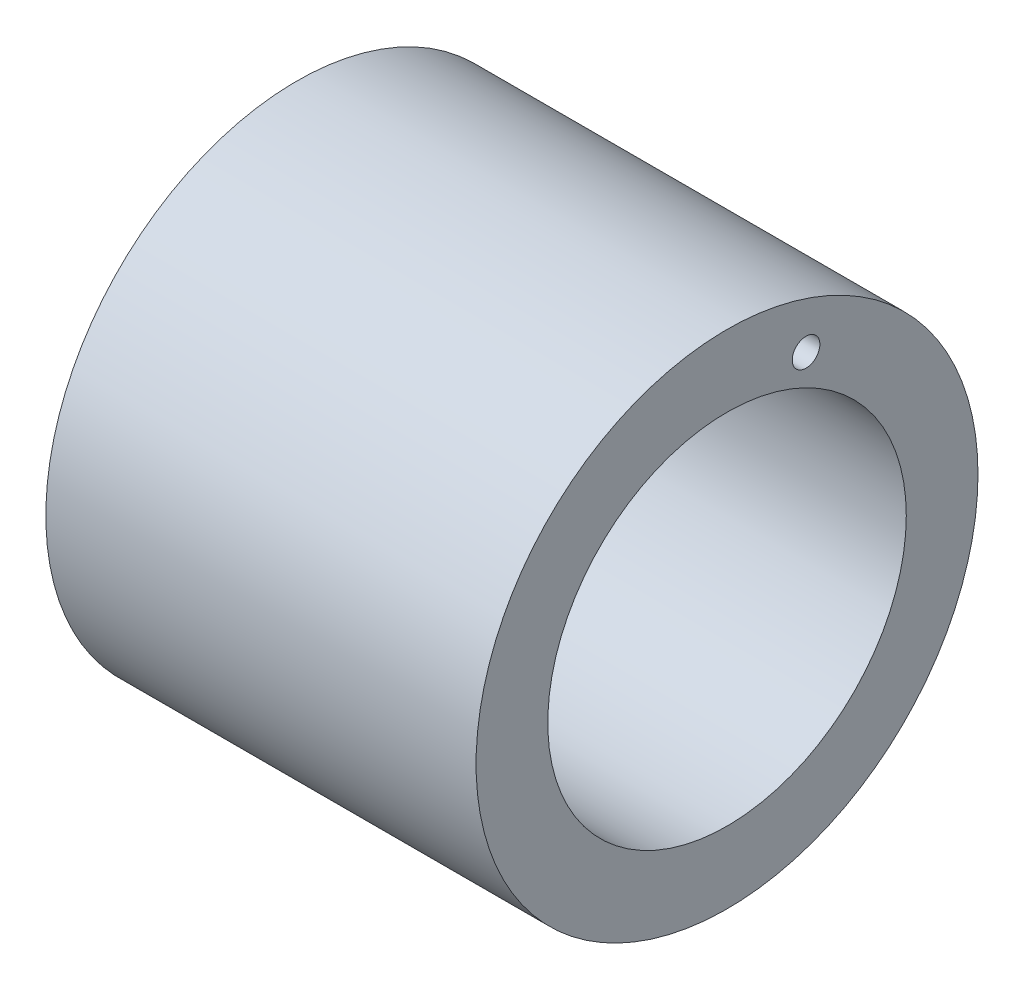
from build123d import *

# Parameters (mm, degrees)
SKETCH1_R           = 14
SKETCH1_R_2         = 10
EXTRUDE_THIN1_DEPTH = 24
SKETCH2_R           = 0.77071999
CUT_EXTRUDE1_DEPTH  = 10


with BuildPart() as part:
    # Sketch1 → Extrude-Thin1 (new body)
    with BuildSketch(Plane(origin=(0, 0, 0), x_dir=(0, 0, -1), z_dir=(1, 0, 0))):
        Circle(SKETCH1_R)
        Circle(SKETCH1_R_2, mode=Mode.SUBTRACT)
    extrude(amount=EXTRUDE_THIN1_DEPTH)

    # Sketch2 → Cut-Extrude1 (cut)
    with BuildSketch(Plane(origin=(24, 0, 0), x_dir=(0, 0, -1), z_dir=(1, 0, 0))):
        with Locations((4.407879167, 10.693032536)):
            Circle(SKETCH2_R)
    extrude(amount=-CUT_EXTRUDE1_DEPTH, mode=Mode.SUBTRACT)


solid = part.part
